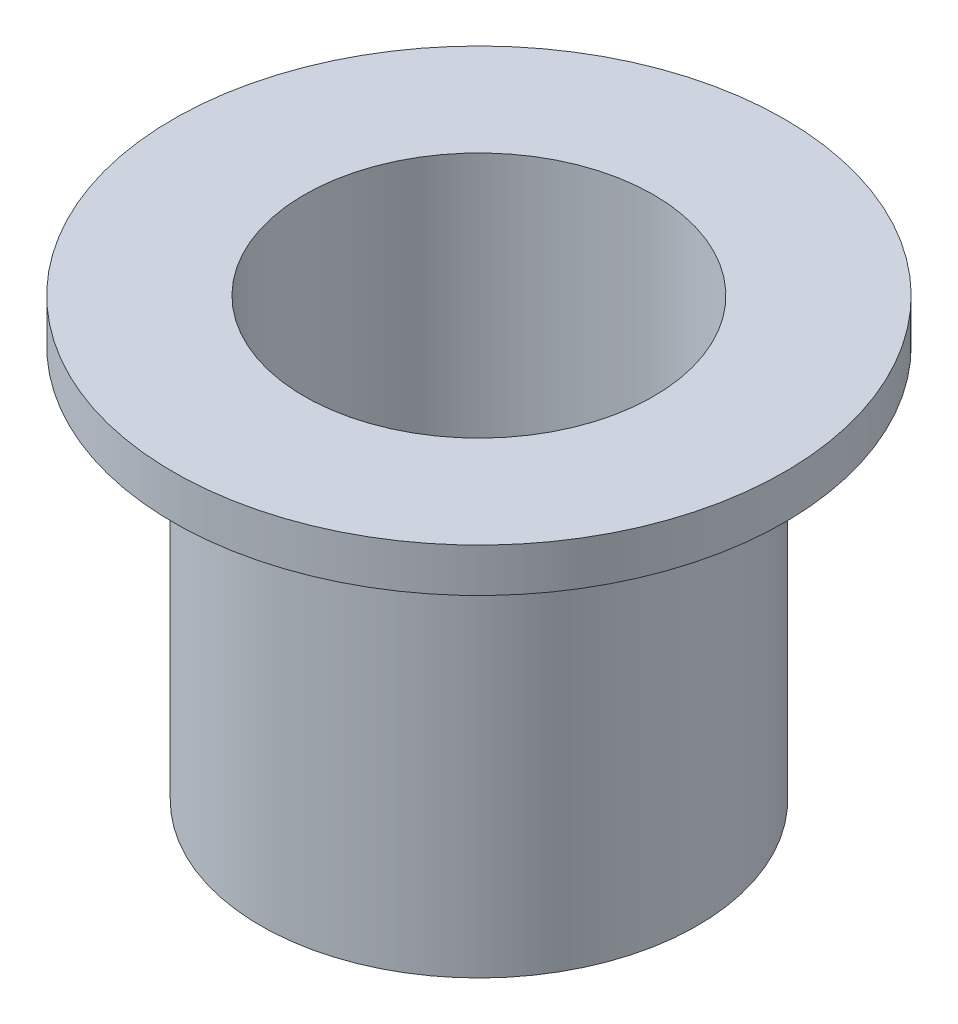
from build123d import *


with BuildPart() as part:
    # Sketch1 → Revolve1 (revolve)
    with BuildSketch(Plane.XY, mode=Mode.PRIVATE) as revolve1_sk:
        Polygon((-12.7, -2.054411765), (-12.7, 29.695588235), (-22.225, 29.695588235), (-22.225, 26.520588235), (-15.875, 26.520588235), (-15.875, -2.054411765), align=None)
    revolve(revolve1_sk.sketch.rotate(Axis((0, 0, 0), (0, 1, 0)), 270), axis=Axis((0, 0, 0), (0, 1, 0)))


solid = part.part
